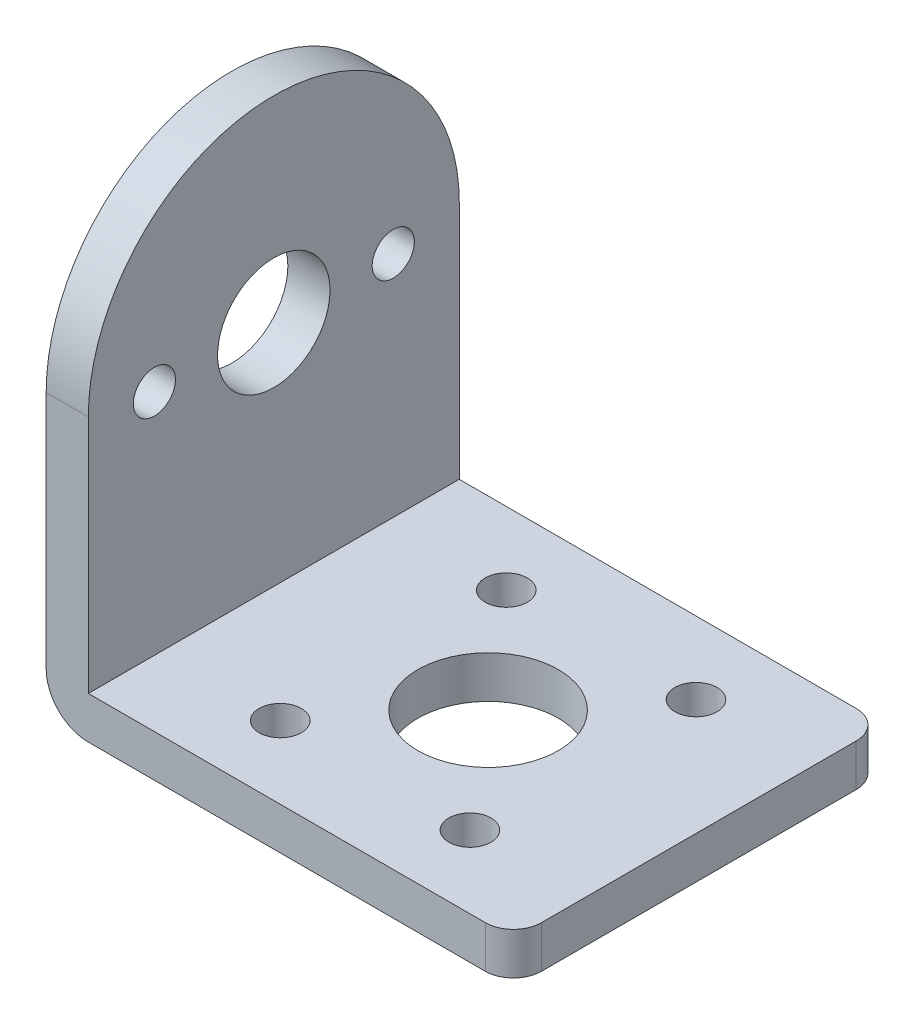
from build123d import *

# Parameters (mm, degrees)
SKETCH1_W               = 30.25
SKETCH1_H               = 26.4
BOSS_EXTRUDE1_DEPTH     = 3
SKETCH1_3_W             = 3
SKETCH1_3_H             = 26.4
BOSS_EXTRUDE2_DEPTH     = 33.25
FILLET1_R               = 3
CUT_EXTRUDE1_DEPTH      = 47.849386335
CUT_EXTRUDE1_DEPTH_BACK = 47.849386335
FILLET2_R               = 2
SKETCH3_R               = 4
SKETCH3_R_2             = 1.5
CUT_EXTRUDE2_DEPTH      = 47.849386335
CUT_EXTRUDE3_REACH      = 38.955
SKETCH4_R               = 5
SKETCH4_R_2             = 1.5


with BuildPart() as part:
    # Sketch1 → Boss-Extrude1 (new body)
    with BuildSketch(Plane(origin=(0, 0, 0), x_dir=(1, 0, 0), z_dir=(0, 1, 0))):
        with Locations((1.5, 0)):
            Rectangle(SKETCH1_W, SKETCH1_H)
    extrude(amount=BOSS_EXTRUDE1_DEPTH)

    # Sketch1<3> → Boss-Extrude2 (add)
    with BuildSketch(Plane(origin=(0, 0, 0), x_dir=(1, 0, 0), z_dir=(0, 1, 0))):
        with Locations((-15.125, 0)):
            Rectangle(SKETCH1_3_W, SKETCH1_3_H)
    extrude(amount=BOSS_EXTRUDE2_DEPTH)

    # Fillet1
    fillet1_edges = [part.edges().sort_by_distance(p)[0] for p in [
        (-16.625, 0, 0),
    ]]
    fillet(fillet1_edges, radius=FILLET1_R)

    # Sketch2 → Cut-Extrude1 (cut, two sides: drawn at the far end of the back side and taken through both)
    with BuildSketch(Plane(origin=(-13.625, 0, 0), x_dir=(0, 0, -1), z_dir=(1, 0, 0)).offset(-CUT_EXTRUDE1_DEPTH_BACK)):
        with BuildLine():
            Line((-13.2, 33.25), (-13.2, 20.05))
            ThreePointArc((-13.2, 20.05), (-9.333809512, 29.383809512), (0, 33.25))
            Line((0, 33.25), (-13.2, 33.25))
        make_face()
        with BuildLine():
            ThreePointArc((0, 33.25), (9.333809512, 29.383809512), (13.2, 20.05))
            Line((13.2, 20.05), (13.2, 33.25))
            Line((13.2, 33.25), (0, 33.25))
        make_face()
    extrude(amount=CUT_EXTRUDE1_DEPTH + CUT_EXTRUDE1_DEPTH_BACK, mode=Mode.SUBTRACT)

    # Fillet2
    fillet2_edges = [part.edges().sort_by_distance(p)[0] for p in [
        (16.625, 1.5, 13.2),
        (16.625, 1.5, -13.2),
    ]]
    fillet(fillet2_edges, radius=FILLET2_R)

    # Sketch3 → Cut-Extrude2 (cut, through all)
    with BuildSketch(Plane(origin=(-13.625, 0, 0), x_dir=(0, 0, -1), z_dir=(1, 0, 0))):
        with Locations((0, 19.25)):
            Circle(SKETCH3_R)
        with Locations((8.5, 19.25)):
            Circle(SKETCH3_R_2)
        with Locations((-8.5, 19.25)):
            Circle(SKETCH3_R_2)
    extrude(amount=-CUT_EXTRUDE2_DEPTH, mode=Mode.SUBTRACT)

    # Sketch4 → Cut-Extrude3 (cut, up to next)
    with BuildSketch(Plane(origin=(0, 3, 0), x_dir=(1, 0, 0), z_dir=(0, 1, 0)), mode=Mode.PRIVATE) as cut_extrude3_sk1:
        with Locations(Location((1.625, 0, 0), (0, 0, 270))):
            Circle(SKETCH4_R)
    cut_extrude3_tool1 = extrude(cut_extrude3_sk1.sketch, amount=-CUT_EXTRUDE3_REACH, mode=Mode.PRIVATE) & part.part
    # Sketch4 → Cut-Extrude3 (cut, up to next)
    with BuildSketch(Plane(origin=(0, 3, 0), x_dir=(1, 0, 0), z_dir=(0, 1, 0)), mode=Mode.PRIVATE) as cut_extrude3_sk2:
        with Locations(Location((-5.125, -8.042853971, 0), (0, 0, 270))):
            Circle(SKETCH4_R_2)
    cut_extrude3_tool2 = extrude(cut_extrude3_sk2.sketch, amount=-CUT_EXTRUDE3_REACH, mode=Mode.PRIVATE) & part.part
    # Sketch4 → Cut-Extrude3 (cut, up to next)
    with BuildSketch(Plane(origin=(0, 3, 0), x_dir=(1, 0, 0), z_dir=(0, 1, 0)), mode=Mode.PRIVATE) as cut_extrude3_sk3:
        with Locations(Location((8.375, 8.042853971, 0), (0, 0, 270))):
            Circle(SKETCH4_R_2)
    cut_extrude3_tool3 = extrude(cut_extrude3_sk3.sketch, amount=-CUT_EXTRUDE3_REACH, mode=Mode.PRIVATE) & part.part
    # Sketch4 → Cut-Extrude3 (cut, up to next)
    with BuildSketch(Plane(origin=(0, 3, 0), x_dir=(1, 0, 0), z_dir=(0, 1, 0)), mode=Mode.PRIVATE) as cut_extrude3_sk4:
        with Locations(Location((8.375, -8.042853971, 0), (0, 0, 270))):
            Circle(SKETCH4_R_2)
    cut_extrude3_tool4 = extrude(cut_extrude3_sk4.sketch, amount=-CUT_EXTRUDE3_REACH, mode=Mode.PRIVATE) & part.part
    # Sketch4 → Cut-Extrude3 (cut, up to next)
    with BuildSketch(Plane(origin=(0, 3, 0), x_dir=(1, 0, 0), z_dir=(0, 1, 0)), mode=Mode.PRIVATE) as cut_extrude3_sk5:
        with Locations(Location((-5.125, 8.042853971, 0), (0, 0, 270))):
            Circle(SKETCH4_R_2)
    cut_extrude3_tool5 = extrude(cut_extrude3_sk5.sketch, amount=-CUT_EXTRUDE3_REACH, mode=Mode.PRIVATE) & part.part
    add(cut_extrude3_tool1.solids().sort_by_distance((1.625, 3, 0))[0], mode=Mode.SUBTRACT)
    add(cut_extrude3_tool2.solids().sort_by_distance((-5.125, 3, 8.042854))[0], mode=Mode.SUBTRACT)
    add(cut_extrude3_tool3.solids().sort_by_distance((8.375, 3, -8.042854))[0], mode=Mode.SUBTRACT)
    add(cut_extrude3_tool4.solids().sort_by_distance((8.375, 3, 8.042854))[0], mode=Mode.SUBTRACT)
    add(cut_extrude3_tool5.solids().sort_by_distance((-5.125, 3, -8.042854))[0], mode=Mode.SUBTRACT)


solid = part.part
